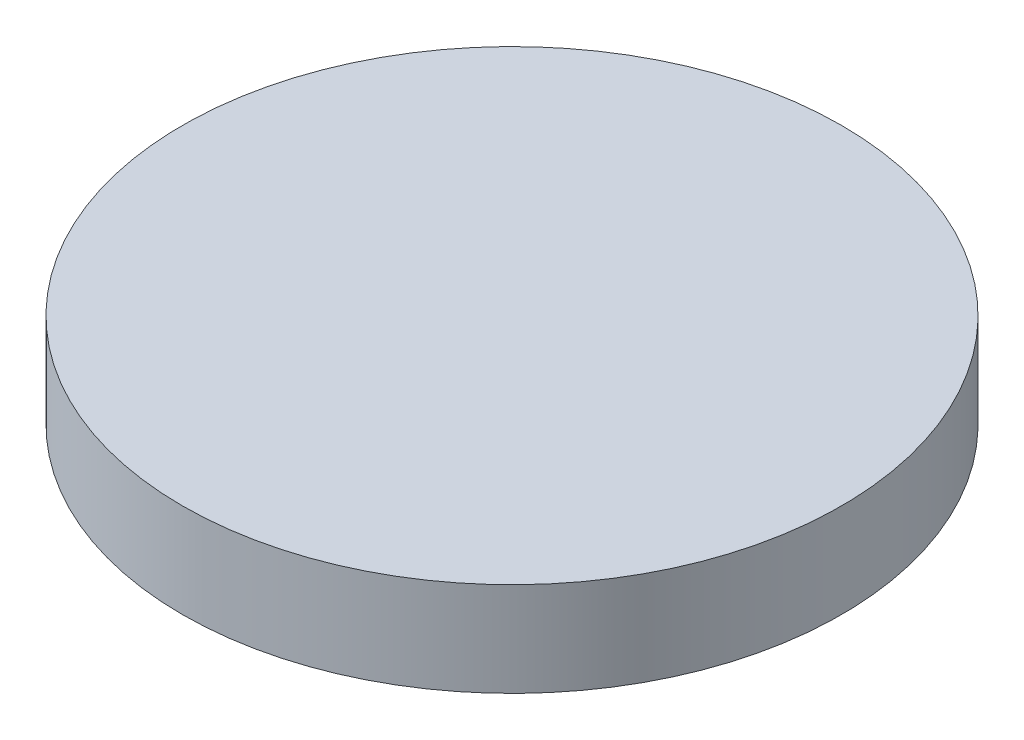
from build123d import *

# Parameters (mm, degrees)
SKETCH_1_R        = 3.5
EXTRUDE_221_DEPTH = 1


with BuildPart() as part:
    # Эскиз1 → Extrude 221 (new body)
    with BuildSketch(Plane(origin=(0, 0, 0), x_dir=(1, 0, 0), z_dir=(0, 1, 0))):
        with Locations(Location((0, 0, 0), (0, 0, 270))):
            Circle(SKETCH_1_R)
    extrude(amount=EXTRUDE_221_DEPTH)


solid = part.part
